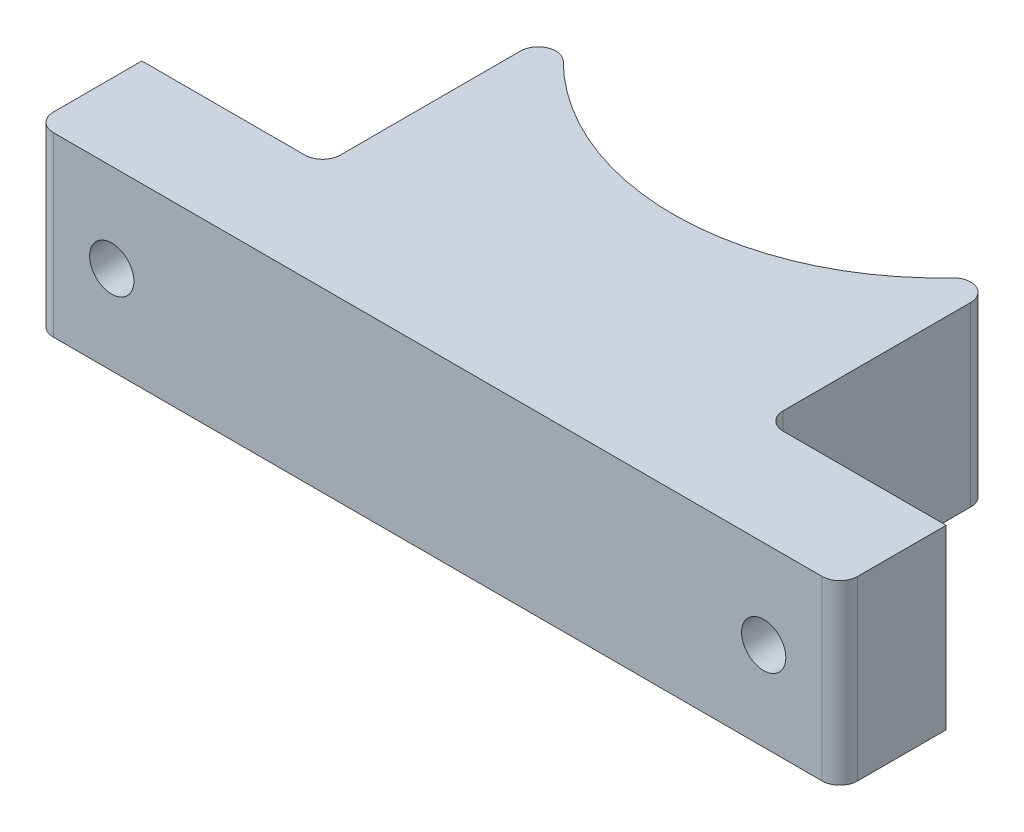
from build123d import *

# Parameters (mm, degrees)
BOSS_EXTRUDE1_DEPTH = 20
CUT_EXTRUDE1_REACH  = 64.285
SKETCH3_R           = 2.5


with BuildPart() as part:
    # Sketch2 → Boss-Extrude1 (new body)
    with BuildSketch(Plane(origin=(0, 0, 0), x_dir=(1, 0, 0), z_dir=(0, 1, 0))):
        with BuildLine():
            Line((-24.6, 28.345199184), (-24.6, 8))
            ThreePointArc((-24.6, 8), (-25.185786438, 6.585786438), (-26.6, 6))
            Line((-26.6, 6), (-45, 6))
            Line((-45, 6), (-45, -4))
            ThreePointArc((-45, -4), (-44.414213562, -5.414213562), (-43, -6))
            Line((-43, -6), (43.8, -6))
            ThreePointArc((43.8, -6), (45.214213562, -5.414213562), (45.8, -4))
            Line((45.8, -4), (45.8, 6))
            Line((45.8, 6), (27.4, 6))
            ThreePointArc((27.4, 6), (25.985786438, 6.585786438), (25.4, 8))
            Line((25.4, 8), (25.4, 29.172494416))
            ThreePointArc((25.4, 29.172494416), (24.133143915, 31.033273823), (21.9375, 30.536713515))
            ThreePointArc((21.9375, 30.536713515), (0.539453133, 21.004850554), (-21.1875, 29.761124235))
            ThreePointArc((-21.1875, 29.761124235), (-23.366485486, 30.192494504), (-24.6, 28.345199184))
        make_face()
    extrude(amount=BOSS_EXTRUDE1_DEPTH)

    # Sketch3 → Cut-Extrude1 (cut, up to next)
    with BuildSketch(Plane.XY.offset(6), mode=Mode.PRIVATE) as cut_extrude1_sk1:
        with Locations((-36.4, 10)):
            Circle(SKETCH3_R)
    cut_extrude1_tool1 = extrude(cut_extrude1_sk1.sketch, amount=-CUT_EXTRUDE1_REACH, mode=Mode.PRIVATE) & part.part
    # Sketch3 → Cut-Extrude1 (cut, up to next)
    with BuildSketch(Plane.XY.offset(6), mode=Mode.PRIVATE) as cut_extrude1_sk2:
        with Locations((37.2, 10)):
            Circle(SKETCH3_R)
    cut_extrude1_tool2 = extrude(cut_extrude1_sk2.sketch, amount=-CUT_EXTRUDE1_REACH, mode=Mode.PRIVATE) & part.part
    add(cut_extrude1_tool1.solids().sort_by_distance((-36.4, 10, 6))[0], mode=Mode.SUBTRACT)
    add(cut_extrude1_tool2.solids().sort_by_distance((37.2, 10, 6))[0], mode=Mode.SUBTRACT)


solid = part.part
